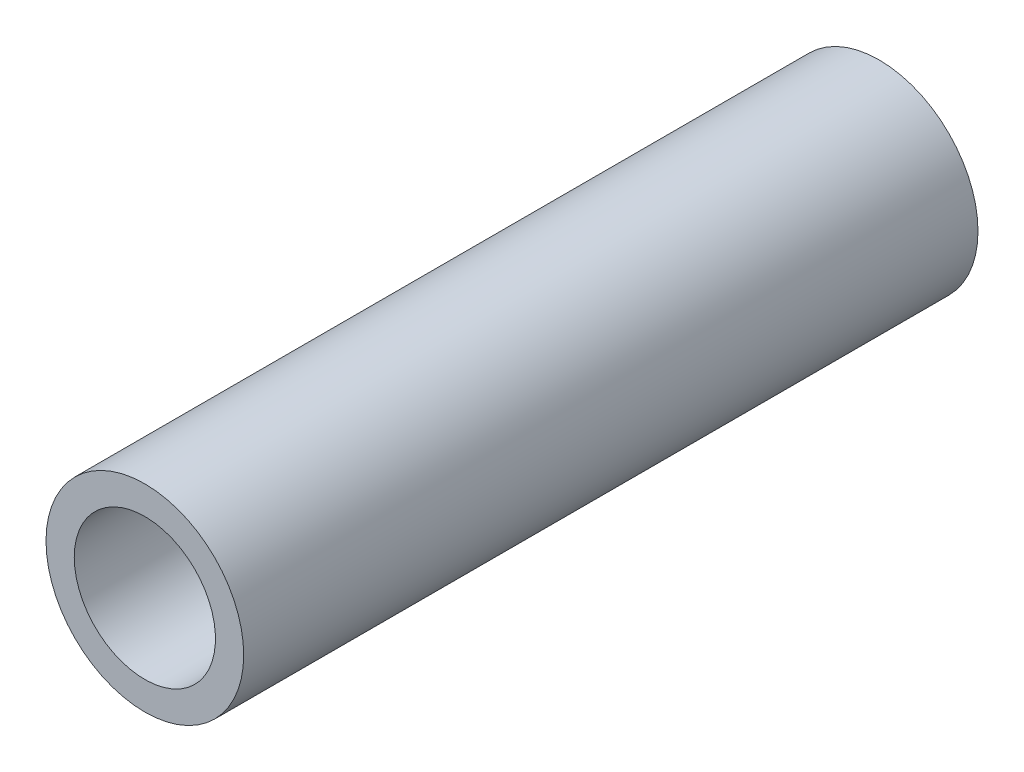
from build123d import *

# Parameters (mm, degrees)
SKETCH_1_R      = 7
SKETCH_1_R_2    = 5
EXTRUDE_1_DEPTH = 26


with BuildPart() as part:
    # 草图1 → 凸台-拉伸1 (new, symmetric)
    with BuildSketch(Plane.XY):
        with Locations(Location((0, 0, 0), (0, 0, 180))):
            Circle(SKETCH_1_R)
        with Locations(Location((0, 0, 0), (0, 0, 180))):
            Circle(SKETCH_1_R_2, mode=Mode.SUBTRACT)
    extrude(amount=EXTRUDE_1_DEPTH, both=True)


solid = part.part
